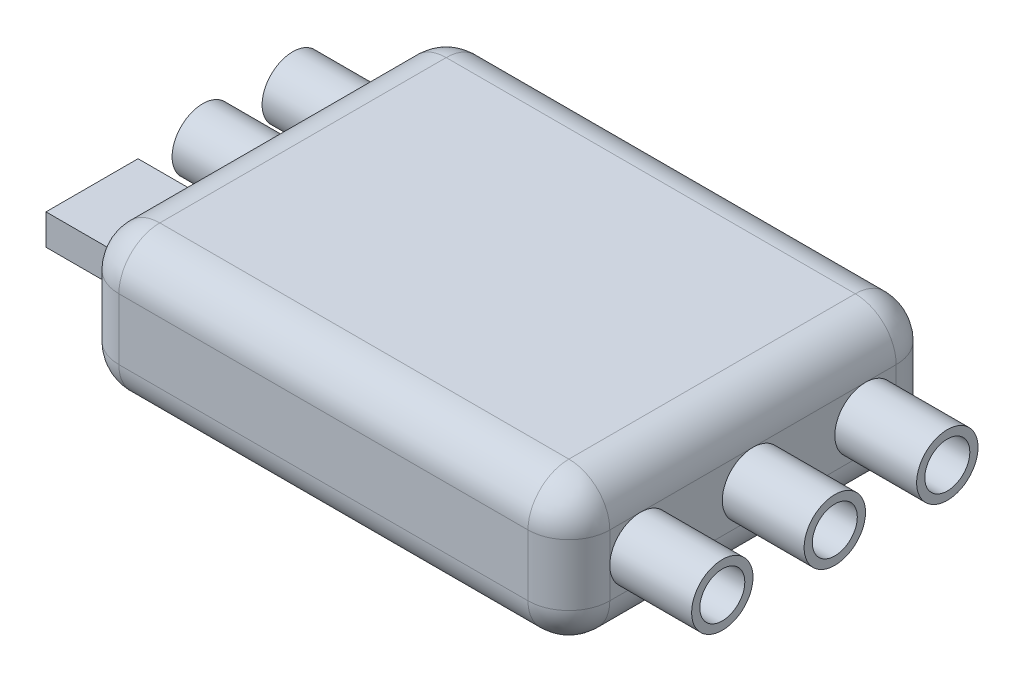
from build123d import *

# Parameters (mm, degrees)
BOSS_EXTRUDE1_DEPTH = 7
FILLET1_R           = 2
SKETCH2_R           = 1.5
SKETCH2_R_2         = 1.1
BOSS_EXTRUDE2_DEPTH = 4
BOSS_EXTRUDE4_START = 4
SKETCH3_R           = 1.5
SKETCH3_R_2         = 1.1
SKETCH3_W           = 4.5
SKETCH3_H           = 1.5
BOSS_EXTRUDE4_DEPTH = 4


with BuildPart() as part:
    # Sketch1 → Boss-Extrude1 (new body)
    with BuildSketch(Plane(origin=(0, 0, 0), x_dir=(1, 0, 0), z_dir=(0, 1, 0))):
        with BuildLine():
            Line((10, -9), (-10, -9))
            ThreePointArc((-10, -9), (-11.414213562, -8.414213562), (-12, -7))
            Line((-12, -7), (-12, 7))
            ThreePointArc((-12, 7), (-11.414213562, 8.414213562), (-10, 9))
            Line((-10, 9), (10, 9))
            ThreePointArc((10, 9), (11.414213562, 8.414213562), (12, 7))
            Line((12, 7), (12, -7))
            ThreePointArc((12, -7), (11.414213562, -8.414213562), (10, -9))
        make_face()
    extrude(amount=BOSS_EXTRUDE1_DEPTH)

    # Fillet1
    fillet1_edges = [part.edges().sort_by_distance(p)[0] for p in [
        (12, 0, 0),
        (11.414213562, 0, 8.414213562),
        (0, 0, 9),
        (-11.414213562, 0, 8.414213562),
        (11.414213562, 7, 8.414213562),
        (12, 7, 0),
        (11.414213562, 7, -8.414213562),
        (0, 7, -9),
        (-11.414213562, 7, -8.414213562),
        (-12, 7, 0),
        (-11.414213562, 7, 8.414213562),
        (-12, 0, 0),
        (0, 7, 9),
        (-11.414213562, 0, -8.414213562),
        (0, 0, -9),
        (11.414213562, 0, -8.414213562),
    ]]
    fillet(fillet1_edges, radius=FILLET1_R)

    # Sketch2 → Boss-Extrude2 (add)
    # profile 1 of 3: a face of its own
    with BuildSketch(Plane(origin=(12, 0, 0), x_dir=(0, 0, -1), z_dir=(1, 0, 0))):
        with Locations(Location((0, 3.5, 0), (0, 0, 270))):
            Circle(SKETCH2_R)
        with Locations((0, 3.5)):
            Circle(SKETCH2_R_2, mode=Mode.SUBTRACT)
    # profile 2 of 3: a face of its own
    with BuildSketch(Plane(origin=(12, 0, 0), x_dir=(0, 0, -1), z_dir=(1, 0, 0))):
        with Locations(Location((-5.5, 3.5, 0), (0, 0, 180))):
            Circle(SKETCH2_R)
        with Locations((-5.5, 3.5)):
            Circle(SKETCH2_R_2, mode=Mode.SUBTRACT)
    # profile 3 of 3: a face of its own
    with BuildSketch(Plane(origin=(12, 0, 0), x_dir=(0, 0, -1), z_dir=(1, 0, 0))):
        with Locations((5.5, 3.5)):
            Circle(SKETCH2_R)
        with Locations((5.5, 3.5)):
            Circle(SKETCH2_R_2, mode=Mode.SUBTRACT)
    extrude(amount=BOSS_EXTRUDE2_DEPTH)

    # Sketch3 → Boss-Extrude4 (add)
    # profile 1 of 3: a face of its own
    with BuildSketch(Plane.ZY.offset(12).offset(BOSS_EXTRUDE4_START)):
        with Locations(Location((-5.5, 3.5, 0), (0, 0, 180))):
            Circle(SKETCH3_R)
        with Locations(Location((-5.5, 3.5, 0), (0, 0, 180))):
            Circle(SKETCH3_R_2, mode=Mode.SUBTRACT)
    # profile 2 of 3: a face of its own
    with BuildSketch(Plane.ZY.offset(12).offset(BOSS_EXTRUDE4_START)):
        with Locations(Location((-1.1, 3.5, 0), (0, 0, 270))):
            Circle(SKETCH3_R)
        with Locations((-1.1, 3.5)):
            Circle(SKETCH3_R_2, mode=Mode.SUBTRACT)
    # profile 3 of 3: a face of its own
    with BuildSketch(Plane.ZY.offset(12).offset(BOSS_EXTRUDE4_START)):
        with Locations((4.313401346, 3.5)):
            Rectangle(SKETCH3_W, SKETCH3_H)
    extrude(amount=-BOSS_EXTRUDE4_DEPTH)


solid = part.part
